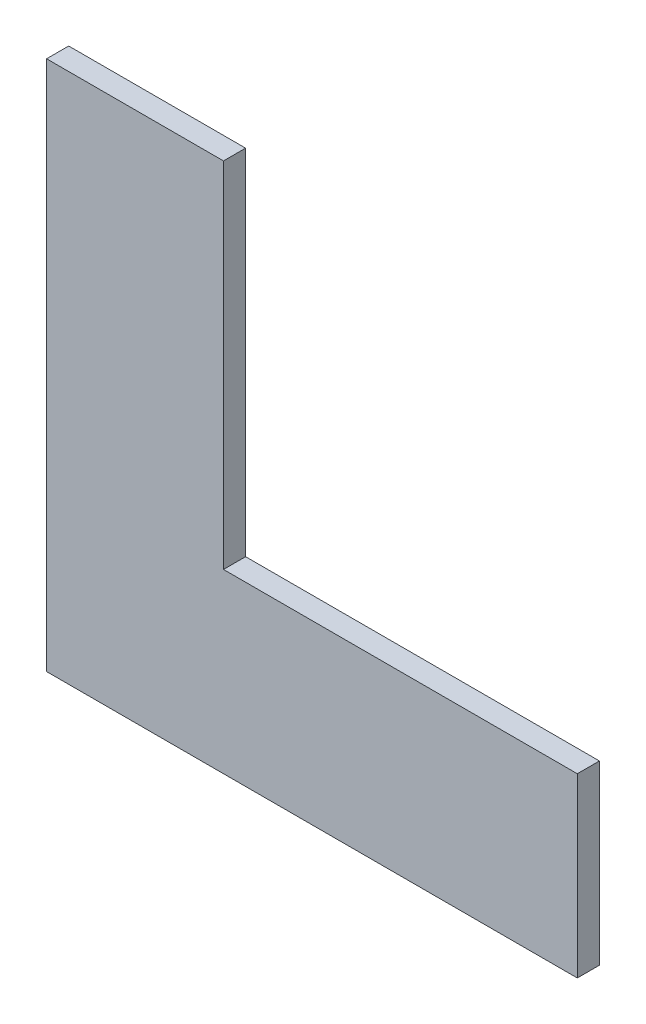
from build123d import *

# Parameters (mm, degrees)
BOSS_EXTRUDE1_DEPTH = 3.175


with BuildPart() as part:
    # Sketch3 → Boss-Extrude1 (new body)
    with BuildSketch(Plane.XY):
        Polygon((-38.1, 38.1), (-12.7, 38.1), (-12.7, -12.7), (38.1, -12.7), (38.1, -38.1), (-38.1, -38.1), align=None)
    extrude(amount=BOSS_EXTRUDE1_DEPTH)


solid = part.part
